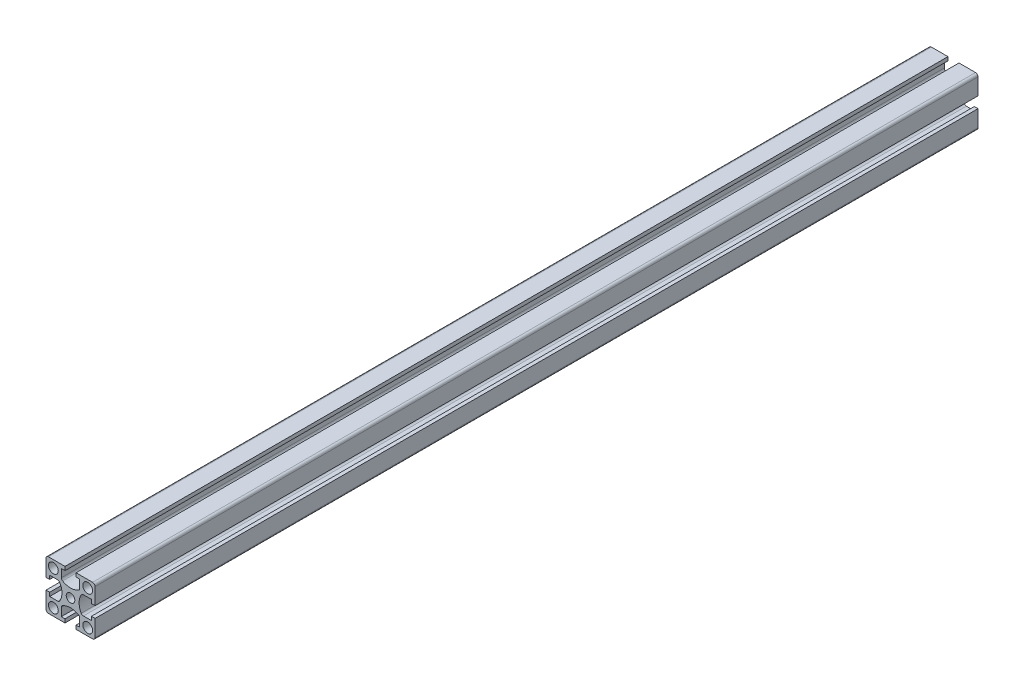
from build123d import *

# Parameters (mm, degrees)
SKETCH1_R           = 2.5
SKETCH1_R_2         = 2.1875
BOSS_EXTRUDE1_DEPTH = 450


with BuildPart() as part:
    # Sketch1 → Boss-Extrude1 (new body)
    with BuildSketch(Plane.XY):
        with BuildLine():
            Line((-12.5, 11.25), (-12.5, 2.8125))
            Line((-12.5, 2.8125), (-10.625, 2.8125))
            Line((-10.625, 2.8125), (-10.625, 4.6875))
            Line((-10.625, 4.6875), (-6.546075349, 4.6875))
            ThreePointArc((-6.546075349, 4.6875), (-5.921075349, 4.520031755), (-5.463543594, 4.0625))
            ThreePointArc((-5.463543594, 4.0625), (-4.375, 0), (-5.463543594, -4.0625))
            ThreePointArc((-5.463543594, -4.0625), (-5.921075349, -4.520031755), (-6.546075349, -4.6875))
            Line((-6.546075349, -4.6875), (-10.625, -4.6875))
            Line((-10.625, -4.6875), (-10.625, -2.8125))
            Line((-10.625, -2.8125), (-12.5, -2.8125))
            Line((-12.5, -2.8125), (-12.5, -11.25))
            ThreePointArc((-12.5, -11.25), (-12.133883476, -12.133883476), (-11.25, -12.5))
            Line((-11.25, -12.5), (-2.8125, -12.5))
            Line((-2.8125, -12.5), (-2.8125, -10.625))
            Line((-2.8125, -10.625), (-4.6875, -10.625))
            Line((-4.6875, -10.625), (-4.6875, -6.546075349))
            ThreePointArc((-4.6875, -6.546075349), (-4.520031755, -5.921075349), (-4.0625, -5.463543594))
            ThreePointArc((-4.0625, -5.463543594), (0, -4.375), (4.0625, -5.463543594))
            ThreePointArc((4.0625, -5.463543594), (4.520031755, -5.921075349), (4.6875, -6.546075349))
            Line((4.6875, -6.546075349), (4.6875, -10.625))
            Line((4.6875, -10.625), (2.8125, -10.625))
            Line((2.8125, -10.625), (2.8125, -12.5))
            Line((2.8125, -12.5), (11.25, -12.5))
            ThreePointArc((11.25, -12.5), (12.133883476, -12.133883476), (12.5, -11.25))
            Line((12.5, -11.25), (12.5, -2.8125))
            Line((12.5, -2.8125), (10.625, -2.8125))
            Line((10.625, -2.8125), (10.625, -4.6875))
            Line((10.625, -4.6875), (6.546075349, -4.6875))
            ThreePointArc((6.546075349, -4.6875), (5.921075349, -4.520031755), (5.463543594, -4.0625))
            ThreePointArc((5.463543594, -4.0625), (4.375, 0), (5.463543594, 4.0625))
            ThreePointArc((5.463543594, 4.0625), (5.921075349, 4.520031755), (6.546075349, 4.6875))
            Line((6.546075349, 4.6875), (10.625, 4.6875))
            Line((10.625, 4.6875), (10.625, 2.8125))
            Line((10.625, 2.8125), (12.5, 2.8125))
            Line((12.5, 2.8125), (12.5, 11.25))
            ThreePointArc((12.5, 11.25), (12.133883476, 12.133883476), (11.25, 12.5))
            Line((11.25, 12.5), (2.8125, 12.5))
            Line((2.8125, 12.5), (2.8125, 10.625))
            Line((2.8125, 10.625), (4.6875, 10.625))
            Line((4.6875, 10.625), (4.6875, 6.546075349))
            ThreePointArc((4.6875, 6.546075349), (4.520031755, 5.921075349), (4.0625, 5.463543594))
            ThreePointArc((4.0625, 5.463543594), (0, 4.375), (-4.0625, 5.463543594))
            ThreePointArc((-4.0625, 5.463543594), (-4.520031755, 5.921075349), (-4.6875, 6.546075349))
            Line((-4.6875, 6.546075349), (-4.6875, 10.625))
            Line((-4.6875, 10.625), (-2.8125, 10.625))
            Line((-2.8125, 10.625), (-2.8125, 12.5))
            Line((-2.8125, 12.5), (-11.25, 12.5))
            ThreePointArc((-11.25, 12.5), (-12.133883476, 12.133883476), (-12.5, 11.25))
        make_face()
        with Locations((-8.75, -8.75)):
            Circle(SKETCH1_R, mode=Mode.SUBTRACT)
        with Locations((8.75, -8.75)):
            Circle(SKETCH1_R, mode=Mode.SUBTRACT)
        with Locations((8.75, 8.75)):
            Circle(SKETCH1_R, mode=Mode.SUBTRACT)
        Circle(SKETCH1_R_2, mode=Mode.SUBTRACT)
        with Locations((-8.75, 8.75)):
            Circle(SKETCH1_R, mode=Mode.SUBTRACT)
    extrude(amount=BOSS_EXTRUDE1_DEPTH)


solid = part.part
